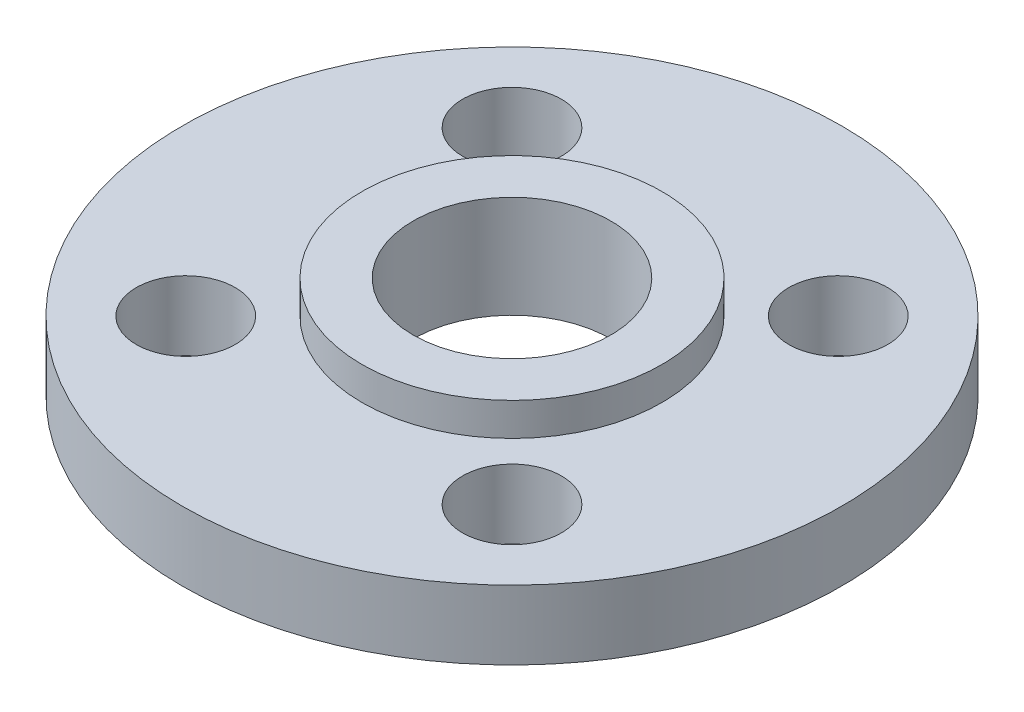
from build123d import *

# Parameters (mm, degrees)
ESQUISSE1_R        = 10
ESQUISSE1_R_2      = 3
ESQUISSE1_R_3      = 1.5
BOSS_EXTRU_1_DEPTH = 2.1
ESQUISSE2_R        = 4.55
ESQUISSE2_R_2      = 3
BOSS_EXTRU_2_DEPTH = 1


with BuildPart() as part:
    # Esquisse1 → Boss.-Extru.1 (new body)
    with BuildSketch(Plane(origin=(0, 0, 0), x_dir=(1, 0, 0), z_dir=(0, 1, 0))):
        with Locations(Location((0, 0, 0), (0, 0, 270))):
            Circle(ESQUISSE1_R)
        with Locations(Location((0, 0, 0), (0, 0, 270))):
            Circle(ESQUISSE1_R_2, mode=Mode.SUBTRACT)
        with Locations(Location((-4.949747468, -4.949747468, 0), (0, 0, 270))):
            Circle(ESQUISSE1_R_3, mode=Mode.SUBTRACT)
        with Locations(Location((-4.949747468, 4.949747468, 0), (0, 0, 270))):
            Circle(ESQUISSE1_R_3, mode=Mode.SUBTRACT)
        with Locations(Location((4.949747468, 4.949747468, 0), (0, 0, 270))):
            Circle(ESQUISSE1_R_3, mode=Mode.SUBTRACT)
        with Locations(Location((4.949747468, -4.949747468, 0), (0, 0, 270))):
            Circle(ESQUISSE1_R_3, mode=Mode.SUBTRACT)
    extrude(amount=BOSS_EXTRU_1_DEPTH)

    # Esquisse2 → Boss.-Extru.2 (add)
    with BuildSketch(Plane(origin=(0, 2.1, 0), x_dir=(1, 0, 0), z_dir=(0, 1, 0))):
        with Locations(Location((0, 0, 0), (0, 0, 270))):
            Circle(ESQUISSE2_R)
        with Locations(Location((0, 0, 0), (0, 0, 270))):
            Circle(ESQUISSE2_R_2, mode=Mode.SUBTRACT)
    extrude(amount=BOSS_EXTRU_2_DEPTH)


solid = part.part
